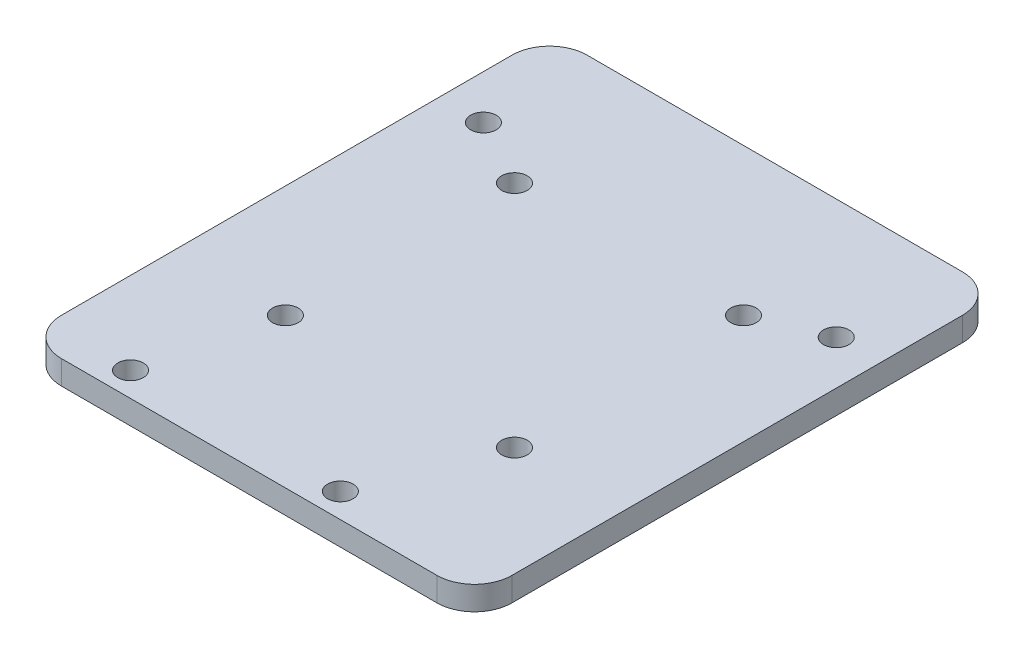
from build123d import *

# Parameters (mm, degrees)
SKETCH1_W            = 60
SKETCH1_H            = 70
BOSS_EXTRUDE1_DEPTH  = 3.175
M3_CLEARANCE_HOLE1_D = 3.4
M3_CLEARANCE_HOLE2_D = 3.4
FILLET1_R            = 5


with BuildPart() as part:
    # Sketch1 → Boss-Extrude1 (new body)
    with BuildSketch(Plane(origin=(0, 0, 0), x_dir=(1, 0, 0), z_dir=(0, 1, 0))):
        Rectangle(SKETCH1_W, SKETCH1_H)
    extrude(amount=BOSS_EXTRUDE1_DEPTH)

    # M3 Clearance Hole1 (through all)
    with Locations(Plane(origin=(0, 3.175, 0), x_dir=(1, 0, 0), z_dir=(0, 1, 0))):
        with Locations((15.425418598, 15.401666056), (15.425418598, -15.098333944), (-15.074581402, -15.098333944), (-15.074581402, 15.401666056)):
            Hole(M3_CLEARANCE_HOLE1_D / 2)

    # M3 Clearance Hole2 (through all)
    with Locations(Plane(origin=(0, 3.175, 0), x_dir=(1, 0, 0), z_dir=(0, 1, 0))):
        with Locations((-19.05, -31.75), (8.89, -31.75), (24.13, 19.05), (-24.13, 20.32)):
            Hole(M3_CLEARANCE_HOLE2_D / 2)

    # Fillet1
    fillet1_edges = [part.edges().sort_by_distance(p)[0] for p in [
        (-30, 1.5875, -35),
        (30, 1.5875, -35),
        (30, 1.5875, 35),
        (-30, 1.5875, 35),
    ]]
    fillet(fillet1_edges, radius=FILLET1_R)


solid = part.part
